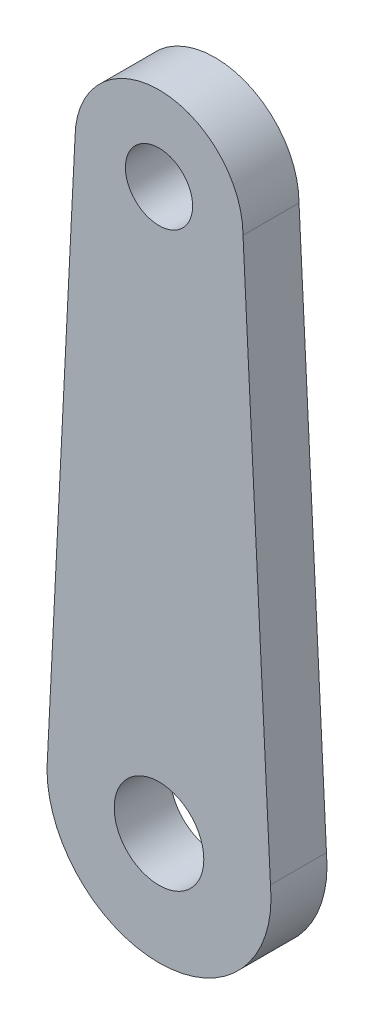
from build123d import *

# Parameters (mm, degrees)
SKETCH1_R           = 4
SKETCH1_R_2         = 3
BOSS_EXTRUDE1_DEPTH = 5


with BuildPart() as part:
    # Sketch1 → Boss-Extrude1 (new body)
    with BuildSketch(Plane.XY):
        with BuildLine():
            Line((-7.5, 50), (-9.950124688, 0.997506234))
            ThreePointArc((-9.950124688, 0.997506234), (0, -10), (9.950124688, 0.997506234))
            Line((9.950124688, 0.997506234), (7.5, 50))
            ThreePointArc((7.5, 50), (0, 57.5), (-7.5, 50))
        make_face()
        Circle(SKETCH1_R, mode=Mode.SUBTRACT)
        with Locations((0, 50)):
            Circle(SKETCH1_R_2, mode=Mode.SUBTRACT)
    extrude(amount=BOSS_EXTRUDE1_DEPTH)


solid = part.part
